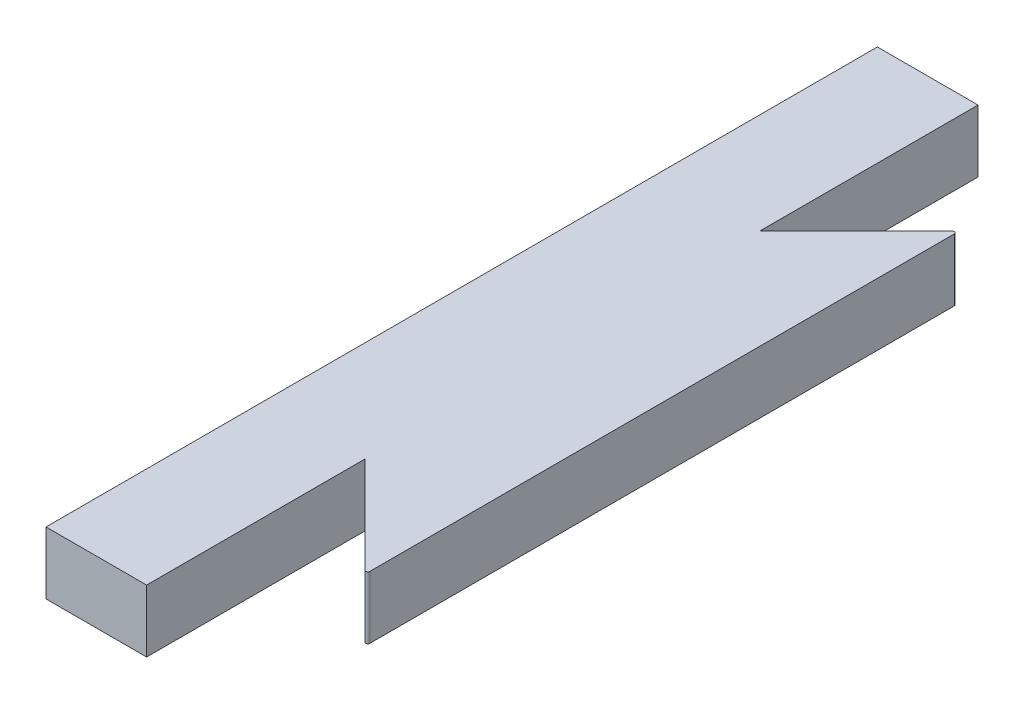
from build123d import *

# Parameters (mm, degrees)
CROQUIS1_R                 = 11
CROQUIS1_R_2               = 2
CROQUIS1_W                 = 30
CROQUIS1_H                 = 3
SALIENTE_EXTRUIR1_DEPTH    = 3
CROQUIS2_R                 = 13
CROQUIS2_R_2               = 11
SALIENTE_EXTRUIR2_DEPTH    = 4
CROQUIS3_R                 = 13
CROQUIS3_R_2               = 9
SALIENTE_EXTRUIR3_DEPTH    = 2
CHAFL_N1_SIZE              = 2
CHAFL_N2_SIZE              = 10
CORTAR_EXTRUIR1_DEPTH      = 10
CORTAR_EXTRUIR1_DEPTH_BACK = 10
CROQUIS4_W                 = 128.833311542
CROQUIS4_H                 = 58.233807115
REDONDEO1_R                = 0.1


with BuildPart() as part:
    # Croquis1 → Saliente-Extruir1 (new body)
    with BuildSketch(Plane(origin=(0, 0, 0), x_dir=(1, 0, 0), z_dir=(0, 1, 0))):
        Polygon((65, 9.5), (69.8, 14.3), (69.8, -14.3), (65, -9.5), (65, -20), (-65, -20), (-65, 20), (65, 20), align=None)
        with Locations((-50.129942902, 0)):
            Circle(CROQUIS1_R, mode=Mode.SUBTRACT)
        with Locations((-28.595127909, 0)):
            Circle(CROQUIS1_R_2, mode=Mode.SUBTRACT)
        with Locations((-13.595127909, 0)):
            Circle(CROQUIS1_R_2, mode=Mode.SUBTRACT)
        with Locations((50, 0)):
            Circle(CROQUIS1_R_2, mode=Mode.SUBTRACT)
        with Locations((25, 11)):
            Rectangle(CROQUIS1_W, CROQUIS1_H, mode=Mode.SUBTRACT)
        with Locations((25, -11)):
            Rectangle(CROQUIS1_W, CROQUIS1_H, mode=Mode.SUBTRACT)
    extrude(amount=SALIENTE_EXTRUIR1_DEPTH)

    # Croquis2 → Saliente-Extruir2 (add)
    with BuildSketch(Plane(origin=(0, 3, 0), x_dir=(1, 0, 0), z_dir=(0, 1, 0))):
        with Locations((-50.129942902, 0)):
            Circle(CROQUIS2_R)
        with Locations((-50.129942902, 0)):
            Circle(CROQUIS2_R_2, mode=Mode.SUBTRACT)
    extrude(amount=SALIENTE_EXTRUIR2_DEPTH)

    # Croquis3 → Saliente-Extruir3 (add)
    with BuildSketch(Plane(origin=(0, 7, 0), x_dir=(1, 0, 0), z_dir=(0, 1, 0))):
        with Locations((-50.129942902, 0)):
            Circle(CROQUIS3_R)
        with Locations((-50.129942902, 0)):
            Circle(CROQUIS3_R_2, mode=Mode.SUBTRACT)
    extrude(amount=SALIENTE_EXTRUIR3_DEPTH)

    # Chaflán1
    chafl_n1_edges = [part.edges().sort_by_distance(p)[0] for p in [
        (-63.129942902, 9, 0),
    ]]
    chamfer(chafl_n1_edges, length=CHAFL_N1_SIZE)

    # Chaflán2
    chafl_n2_edges = [part.edges().sort_by_distance(p)[0] for p in [
        (-65, 1.5, 20),
        (-65, 1.5, -20),
    ]]
    chamfer(chafl_n2_edges, length=CHAFL_N2_SIZE)

    # Croquis4 → Cortar-Extruir1 (cut, two sides: drawn at the far end of the back side and taken through both)
    with BuildSketch(Plane(origin=(0, 3, 0), x_dir=(1, 0, 0), z_dir=(0, 1, 0)).offset(-CORTAR_EXTRUIR1_DEPTH_BACK)):
        with Locations((-4.257997369, -0.71893589)):
            Rectangle(CROQUIS4_W, CROQUIS4_H)
    extrude(amount=CORTAR_EXTRUIR1_DEPTH + CORTAR_EXTRUIR1_DEPTH_BACK, mode=Mode.SUBTRACT)

    # Redondeo1
    redondeo1_edges = [part.edges().sort_by_distance(p)[0] for p in [
        (69.8, 1.5, -14.3),
        (69.8, 1.5, 14.3),
    ]]
    fillet(redondeo1_edges, radius=REDONDEO1_R)


solid = part.part
